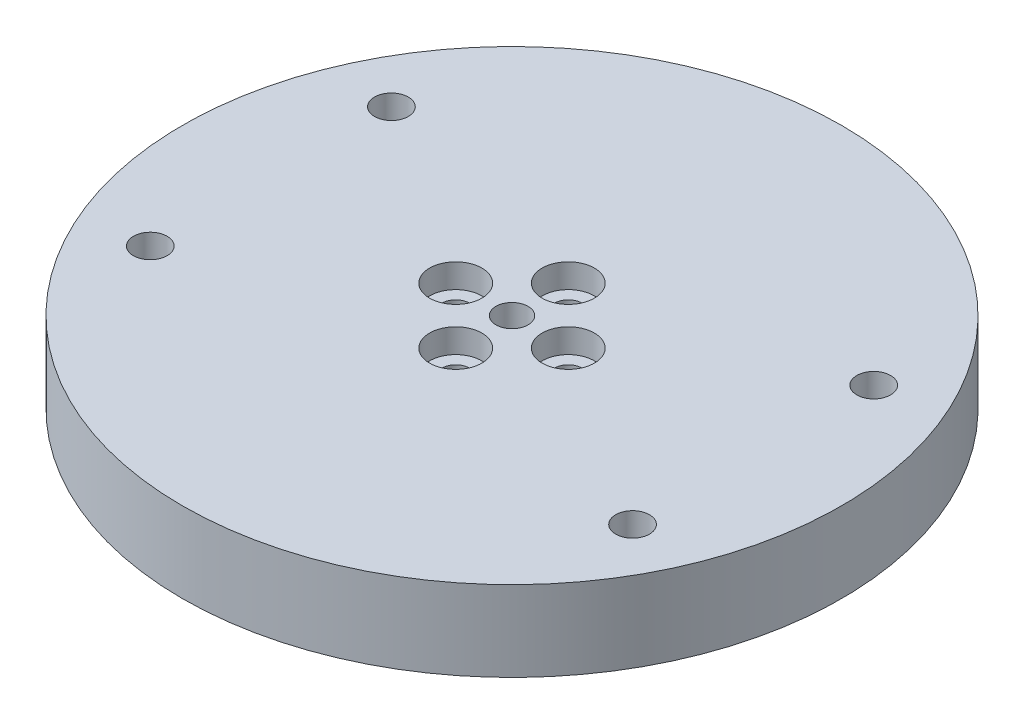
from build123d import *

# Parameters (mm, degrees)
SKETCH1_R           = 41
BOSS_EXTRUDE1_DEPTH = 10
SKETCH2_R           = 10.1
CUT_EXTRUDE1_DEPTH  = 0.5
SKETCH3_R           = 1.7
SKETCH3_R_2         = 2
CUT_EXTRUDE2_DEPTH  = 59.755850772
SKETCH4_R           = 3.25
CUT_EXTRUDE3_DEPTH  = 3
SKETCH5_R           = 2.1
CUT_EXTRUDE4_DEPTH  = 5.5


with BuildPart() as part:
    # Sketch1 → Boss-Extrude1 (new body)
    with BuildSketch(Plane(origin=(0, 0, 0), x_dir=(1, 0, 0), z_dir=(0, 1, 0))):
        with Locations(Location((0, 0, 0), (0, 0, 270))):
            Circle(SKETCH1_R)
    extrude(amount=BOSS_EXTRUDE1_DEPTH)

    # Sketch2 → Cut-Extrude1 (cut)
    with BuildSketch(Plane.XZ):
        with Locations(Location((0, 0, 0), (0, 0, 270))):
            Circle(SKETCH2_R)
    extrude(amount=-CUT_EXTRUDE1_DEPTH, mode=Mode.SUBTRACT)

    # Sketch3 → Cut-Extrude2 (cut, through all)
    with BuildSketch(Plane.XZ.offset(-0.5)):
        with Locations(Location((0, 7, 0), (0, 0, 270))):
            Circle(SKETCH3_R)
        with Locations(Location((7, 0, 0), (0, 0, 270))):
            Circle(SKETCH3_R)
        with Locations(Location((0, -7, 0), (0, 0, 270))):
            Circle(SKETCH3_R)
        with Locations(Location((-7, 0, 0), (0, 0, 270))):
            Circle(SKETCH3_R)
        with Locations(Location((0, 0, 0), (0, 0, 270))):
            Circle(SKETCH3_R_2)
    extrude(amount=-CUT_EXTRUDE2_DEPTH, mode=Mode.SUBTRACT)

    # Sketch4 → Cut-Extrude3 (cut)
    with BuildSketch(Plane(origin=(0, 10, 0), x_dir=(1, 0, 0), z_dir=(0, 1, 0))):
        with Locations(Location((0, 7, 0), (0, 0, 270))):
            Circle(SKETCH4_R)
        with Locations(Location((7, 0, 0), (0, 0, 270))):
            Circle(SKETCH4_R)
        with Locations(Location((0, -7, 0), (0, 0, 270))):
            Circle(SKETCH4_R)
        with Locations(Location((-7, 0, 0), (0, 0, 270))):
            Circle(SKETCH4_R)
    extrude(amount=-CUT_EXTRUDE3_DEPTH, mode=Mode.SUBTRACT)

    # Sketch5 → Cut-Extrude4 (cut)
    with BuildSketch(Plane(origin=(0, 10, 0), x_dir=(1, 0, 0), z_dir=(0, 1, 0))):
        with Locations(Location((-30, 15, 0), (0, 0, 270))):
            Circle(SKETCH5_R)
        with Locations(Location((-30, -15, 0), (0, 0, 270))):
            Circle(SKETCH5_R)
        with Locations(Location((30, 15, 0), (0, 0, 270))):
            Circle(SKETCH5_R)
        with Locations(Location((30, -15, 0), (0, 0, 270))):
            Circle(SKETCH5_R)
    extrude(amount=-CUT_EXTRUDE4_DEPTH, mode=Mode.SUBTRACT)


solid = part.part
